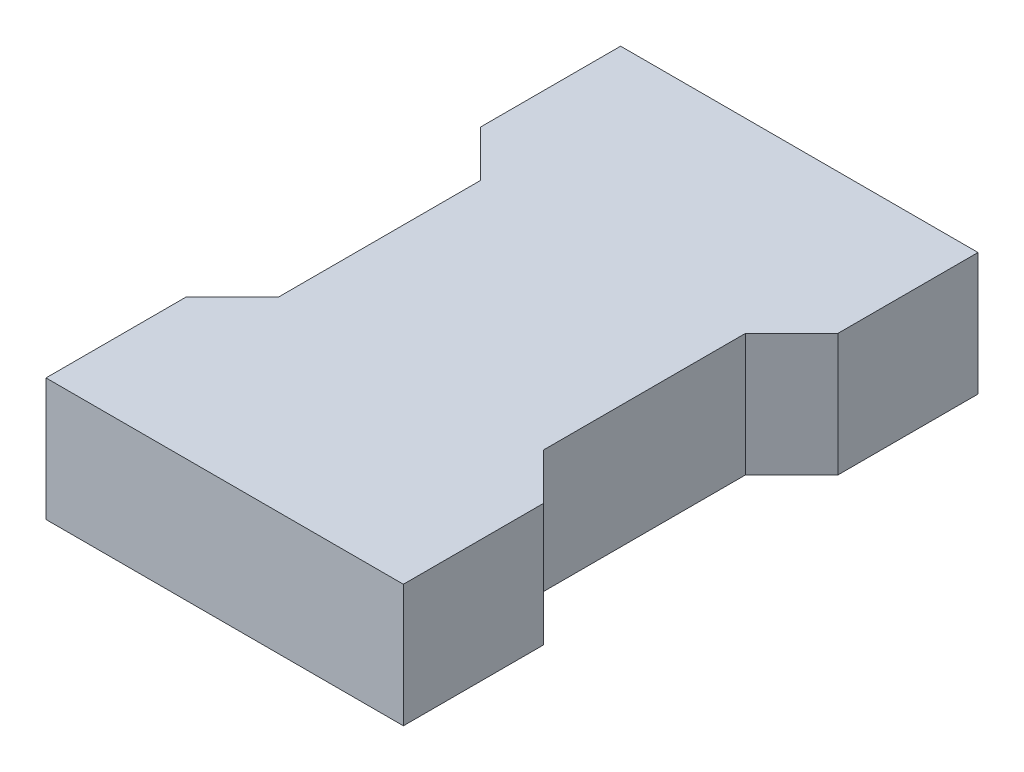
from build123d import *

# Parameters (mm, degrees)
EXTRUDE_1_DEPTH = 17.5


with BuildPart() as part:
    # 草图1 → 凸台-拉伸1 (new body)
    with BuildSketch(Plane(origin=(0, 0, 0), x_dir=(1, 0, 0), z_dir=(0, 1, 0))):
        Polygon((-25.5, 21), (-18.902616279, 14.402616279), (-18.902616279, -14.402616279), (-25.5, -21), (-25.5, -41), (25.5, -41), (25.5, -21), (18.902616279, -14.402616279), (18.902616279, 14.402616279), (25.5, 21), (25.5, 41), (-25.5, 41), align=None)
    extrude(amount=EXTRUDE_1_DEPTH)


solid = part.part
